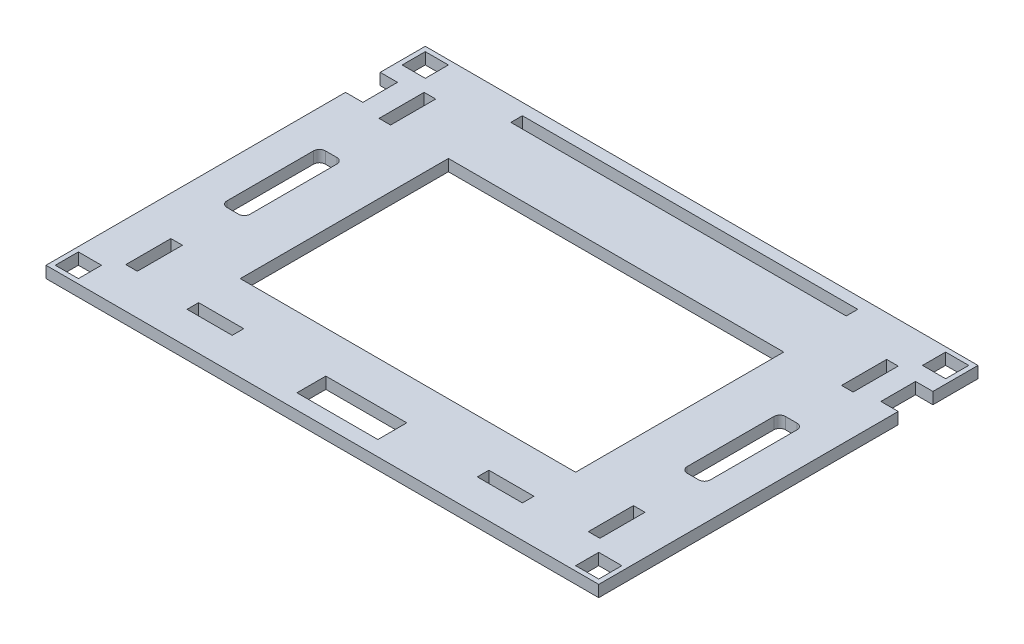
from build123d import *

# Parameters (mm, degrees)
SKETCH1_W           = 478
SKETCH1_H           = 328
BOSS_EXTRUDE1_DEPTH = 10
CUT_EXTRUDE1_REACH  = 302.396
SKETCH2_W           = 20
SKETCH2_H           = 20
CUT_EXTRUDE2_REACH  = 302.396
SKETCH3_W           = 290
SKETCH3_H           = 10
SKETCH3_W_2         = 10
SKETCH3_H_2         = 39
SKETCH3_W_3         = 39
SKETCH3_W_4         = 70
SKETCH3_H_3         = 25
SKETCH3_H_4         = 180
SKETCH3_W_5         = 15
SKETCH3_H_5         = 30


with BuildPart() as part:
    # Sketch1 → Boss-Extrude1 (new body)
    with BuildSketch(Plane(origin=(0, 0, 0), x_dir=(1, 0, 0), z_dir=(0, 1, 0))):
        with Locations((0, -17.705479187)):
            Rectangle(SKETCH1_W, SKETCH1_H)
    extrude(amount=BOSS_EXTRUDE1_DEPTH)

    # Sketch2 → Cut-Extrude1 (cut, up to next)
    with BuildSketch(Plane(origin=(0, 10, 0), x_dir=(1, 0, 0), z_dir=(0, 1, 0)), mode=Mode.PRIVATE) as cut_extrude1_sk1:
        with Locations((-225, 132.294520813)):
            Rectangle(SKETCH2_W, SKETCH2_H)
    cut_extrude1_tool1 = extrude(cut_extrude1_sk1.sketch, amount=-CUT_EXTRUDE1_REACH, mode=Mode.PRIVATE) & part.part
    # Sketch2 → Cut-Extrude1 (cut, up to next)
    with BuildSketch(Plane(origin=(0, 10, 0), x_dir=(1, 0, 0), z_dir=(0, 1, 0)), mode=Mode.PRIVATE) as cut_extrude1_sk2:
        with Locations((-225, -167.705479187)):
            Rectangle(SKETCH2_W, SKETCH2_H)
    cut_extrude1_tool2 = extrude(cut_extrude1_sk2.sketch, amount=-CUT_EXTRUDE1_REACH, mode=Mode.PRIVATE) & part.part
    # Sketch2 → Cut-Extrude1 (cut, up to next)
    with BuildSketch(Plane(origin=(0, 10, 0), x_dir=(1, 0, 0), z_dir=(0, 1, 0)), mode=Mode.PRIVATE) as cut_extrude1_sk3:
        with Locations((225, 132.294520813)):
            Rectangle(SKETCH2_W, SKETCH2_H)
    cut_extrude1_tool3 = extrude(cut_extrude1_sk3.sketch, amount=-CUT_EXTRUDE1_REACH, mode=Mode.PRIVATE) & part.part
    # Sketch2 → Cut-Extrude1 (cut, up to next)
    with BuildSketch(Plane(origin=(0, 10, 0), x_dir=(1, 0, 0), z_dir=(0, 1, 0)), mode=Mode.PRIVATE) as cut_extrude1_sk4:
        with Locations((225, -167.705479187)):
            Rectangle(SKETCH2_W, SKETCH2_H)
    cut_extrude1_tool4 = extrude(cut_extrude1_sk4.sketch, amount=-CUT_EXTRUDE1_REACH, mode=Mode.PRIVATE) & part.part
    add(cut_extrude1_tool1.solids().sort_by_distance((-225, 10, -132.294521))[0], mode=Mode.SUBTRACT)
    add(cut_extrude1_tool2.solids().sort_by_distance((-225, 10, 167.705479))[0], mode=Mode.SUBTRACT)
    add(cut_extrude1_tool3.solids().sort_by_distance((225, 10, -132.294521))[0], mode=Mode.SUBTRACT)
    add(cut_extrude1_tool4.solids().sort_by_distance((225, 10, 167.705479))[0], mode=Mode.SUBTRACT)

    # Sketch3 → Cut-Extrude2 (cut, up to next)
    with BuildSketch(Plane(origin=(0, 10, 0), x_dir=(1, 0, 0), z_dir=(0, 1, 0)), mode=Mode.PRIVATE) as cut_extrude2_sk1:
        with Locations((0, 131.294520813)):
            Rectangle(SKETCH3_W, SKETCH3_H)
    cut_extrude2_tool1 = extrude(cut_extrude2_sk1.sketch, amount=-CUT_EXTRUDE2_REACH, mode=Mode.PRIVATE) & part.part
    # Sketch3 → Cut-Extrude2 (cut, up to next)
    with BuildSketch(Plane(origin=(0, 10, 0), x_dir=(1, 0, 0), z_dir=(0, 1, 0)), mode=Mode.PRIVATE) as cut_extrude2_sk2:
        with Locations((-200, 91.794520813)):
            Rectangle(SKETCH3_W_2, SKETCH3_H_2)
    cut_extrude2_tool2 = extrude(cut_extrude2_sk2.sketch, amount=-CUT_EXTRUDE2_REACH, mode=Mode.PRIVATE) & part.part
    # Sketch3 → Cut-Extrude2 (cut, up to next)
    with BuildSketch(Plane(origin=(0, 10, 0), x_dir=(1, 0, 0), z_dir=(0, 1, 0)), mode=Mode.PRIVATE) as cut_extrude2_sk3:
        with Locations((200, 91.794520813)):
            Rectangle(SKETCH3_W_2, SKETCH3_H_2)
    cut_extrude2_tool3 = extrude(cut_extrude2_sk3.sketch, amount=-CUT_EXTRUDE2_REACH, mode=Mode.PRIVATE) & part.part
    # Sketch3 → Cut-Extrude2 (cut, up to next)
    with BuildSketch(Plane(origin=(0, 10, 0), x_dir=(1, 0, 0), z_dir=(0, 1, 0)), mode=Mode.PRIVATE) as cut_extrude2_sk4:
        with Locations((200, -127.205479187)):
            Rectangle(SKETCH3_W_2, SKETCH3_H_2)
    cut_extrude2_tool4 = extrude(cut_extrude2_sk4.sketch, amount=-CUT_EXTRUDE2_REACH, mode=Mode.PRIVATE) & part.part
    # Sketch3 → Cut-Extrude2 (cut, up to next)
    with BuildSketch(Plane(origin=(0, 10, 0), x_dir=(1, 0, 0), z_dir=(0, 1, 0)), mode=Mode.PRIVATE) as cut_extrude2_sk5:
        with Locations((-200, -127.205479187)):
            Rectangle(SKETCH3_W_2, SKETCH3_H_2)
    cut_extrude2_tool5 = extrude(cut_extrude2_sk5.sketch, amount=-CUT_EXTRUDE2_REACH, mode=Mode.PRIVATE) & part.part
    # Sketch3 → Cut-Extrude2 (cut, up to next)
    with BuildSketch(Plane(origin=(0, 10, 0), x_dir=(1, 0, 0), z_dir=(0, 1, 0)), mode=Mode.PRIVATE) as cut_extrude2_sk6:
        with Locations((-125.5, -148.705479187)):
            Rectangle(SKETCH3_W_3, SKETCH3_H)
    cut_extrude2_tool6 = extrude(cut_extrude2_sk6.sketch, amount=-CUT_EXTRUDE2_REACH, mode=Mode.PRIVATE) & part.part
    # Sketch3 → Cut-Extrude2 (cut, up to next)
    with BuildSketch(Plane(origin=(0, 10, 0), x_dir=(1, 0, 0), z_dir=(0, 1, 0)), mode=Mode.PRIVATE) as cut_extrude2_sk7:
        with Locations((125.5, -148.705479187)):
            Rectangle(SKETCH3_W_3, SKETCH3_H)
    cut_extrude2_tool7 = extrude(cut_extrude2_sk7.sketch, amount=-CUT_EXTRUDE2_REACH, mode=Mode.PRIVATE) & part.part
    # Sketch3 → Cut-Extrude2 (cut, up to next)
    with BuildSketch(Plane(origin=(0, 10, 0), x_dir=(1, 0, 0), z_dir=(0, 1, 0)), mode=Mode.PRIVATE) as cut_extrude2_sk8:
        with Locations((0, -156.205479187)):
            Rectangle(SKETCH3_W_4, SKETCH3_H_3)
    cut_extrude2_tool8 = extrude(cut_extrude2_sk8.sketch, amount=-CUT_EXTRUDE2_REACH, mode=Mode.PRIVATE) & part.part
    # Sketch3 → Cut-Extrude2 (cut, up to next)
    with BuildSketch(Plane(origin=(0, 10, 0), x_dir=(1, 0, 0), z_dir=(0, 1, 0)), mode=Mode.PRIVATE) as cut_extrude2_sk9:
        with BuildLine():
            Line((-204, -60.205479187), (-194, -60.205479187))
            ThreePointArc((-194, -60.205479187), (-190.464466094, -58.741013093), (-189, -55.205479187))
            Line((-189, -55.205479187), (-189, 19.794520813))
            ThreePointArc((-189, 19.794520813), (-190.464466094, 23.330054719), (-194, 24.794520813))
            Line((-194, 24.794520813), (-204, 24.794520813))
            ThreePointArc((-204, 24.794520813), (-207.535533906, 23.330054719), (-209, 19.794520813))
            Line((-209, 19.794520813), (-209, -55.205479187))
            ThreePointArc((-209, -55.205479187), (-207.535533906, -58.741013093), (-204, -60.205479187))
        make_face()
    cut_extrude2_tool9 = extrude(cut_extrude2_sk9.sketch, amount=-CUT_EXTRUDE2_REACH, mode=Mode.PRIVATE) & part.part
    # Sketch3 → Cut-Extrude2 (cut, up to next)
    with BuildSketch(Plane(origin=(0, 10, 0), x_dir=(1, 0, 0), z_dir=(0, 1, 0)), mode=Mode.PRIVATE) as cut_extrude2_sk10:
        with BuildLine():
            Line((189, -55.205479187), (189, 19.794520813))
            ThreePointArc((189, 19.794520813), (190.464466094, 23.330054719), (194, 24.794520813))
            Line((194, 24.794520813), (204, 24.794520813))
            ThreePointArc((204, 24.794520813), (207.535533906, 23.330054719), (209, 19.794520813))
            Line((209, 19.794520813), (209, -55.205479187))
            ThreePointArc((209, -55.205479187), (207.535533906, -58.741013093), (204, -60.205479187))
            Line((204, -60.205479187), (194, -60.205479187))
            ThreePointArc((194, -60.205479187), (190.464466094, -58.741013093), (189, -55.205479187))
        make_face()
    cut_extrude2_tool10 = extrude(cut_extrude2_sk10.sketch, amount=-CUT_EXTRUDE2_REACH, mode=Mode.PRIVATE) & part.part
    # Sketch3 → Cut-Extrude2 (cut, up to next)
    with BuildSketch(Plane(origin=(0, 10, 0), x_dir=(1, 0, 0), z_dir=(0, 1, 0)), mode=Mode.PRIVATE) as cut_extrude2_sk11:
        with Locations((0, -17.705479187)):
            Rectangle(SKETCH3_W, SKETCH3_H_4)
    cut_extrude2_tool11 = extrude(cut_extrude2_sk11.sketch, amount=-CUT_EXTRUDE2_REACH, mode=Mode.PRIVATE) & part.part
    # Sketch3 → Cut-Extrude2 (cut, up to next)
    with BuildSketch(Plane(origin=(0, 10, 0), x_dir=(1, 0, 0), z_dir=(0, 1, 0)), mode=Mode.PRIVATE) as cut_extrude2_sk12:
        with Locations((-231.5, 92.294520813)):
            Rectangle(SKETCH3_W_5, SKETCH3_H_5)
    cut_extrude2_tool12 = extrude(cut_extrude2_sk12.sketch, amount=-CUT_EXTRUDE2_REACH, mode=Mode.PRIVATE) & part.part
    # Sketch3 → Cut-Extrude2 (cut, up to next)
    with BuildSketch(Plane(origin=(0, 10, 0), x_dir=(1, 0, 0), z_dir=(0, 1, 0)), mode=Mode.PRIVATE) as cut_extrude2_sk13:
        with Locations((231.5, 92.294520813)):
            Rectangle(SKETCH3_W_5, SKETCH3_H_5)
    cut_extrude2_tool13 = extrude(cut_extrude2_sk13.sketch, amount=-CUT_EXTRUDE2_REACH, mode=Mode.PRIVATE) & part.part
    add(cut_extrude2_tool1.solids().sort_by_distance((0, 10, -131.294521))[0], mode=Mode.SUBTRACT)
    add(cut_extrude2_tool2.solids().sort_by_distance((-200, 10, -91.794521))[0], mode=Mode.SUBTRACT)
    add(cut_extrude2_tool3.solids().sort_by_distance((200, 10, -91.794521))[0], mode=Mode.SUBTRACT)
    add(cut_extrude2_tool4.solids().sort_by_distance((200, 10, 127.205479))[0], mode=Mode.SUBTRACT)
    add(cut_extrude2_tool5.solids().sort_by_distance((-200, 10, 127.205479))[0], mode=Mode.SUBTRACT)
    add(cut_extrude2_tool6.solids().sort_by_distance((-125.5, 10, 148.705479))[0], mode=Mode.SUBTRACT)
    add(cut_extrude2_tool7.solids().sort_by_distance((125.5, 10, 148.705479))[0], mode=Mode.SUBTRACT)
    add(cut_extrude2_tool8.solids().sort_by_distance((0, 10, 156.205479))[0], mode=Mode.SUBTRACT)
    add(cut_extrude2_tool9.solids().sort_by_distance((-199, 10, 17.705479))[0], mode=Mode.SUBTRACT)
    add(cut_extrude2_tool10.solids().sort_by_distance((199, 10, 17.705479))[0], mode=Mode.SUBTRACT)
    add(cut_extrude2_tool11.solids().sort_by_distance((0, 10, 17.705479))[0], mode=Mode.SUBTRACT)
    add(cut_extrude2_tool12.solids().sort_by_distance((-231.5, 10, -92.294521))[0], mode=Mode.SUBTRACT)
    add(cut_extrude2_tool13.solids().sort_by_distance((231.5, 10, -92.294521))[0], mode=Mode.SUBTRACT)


solid = part.part
